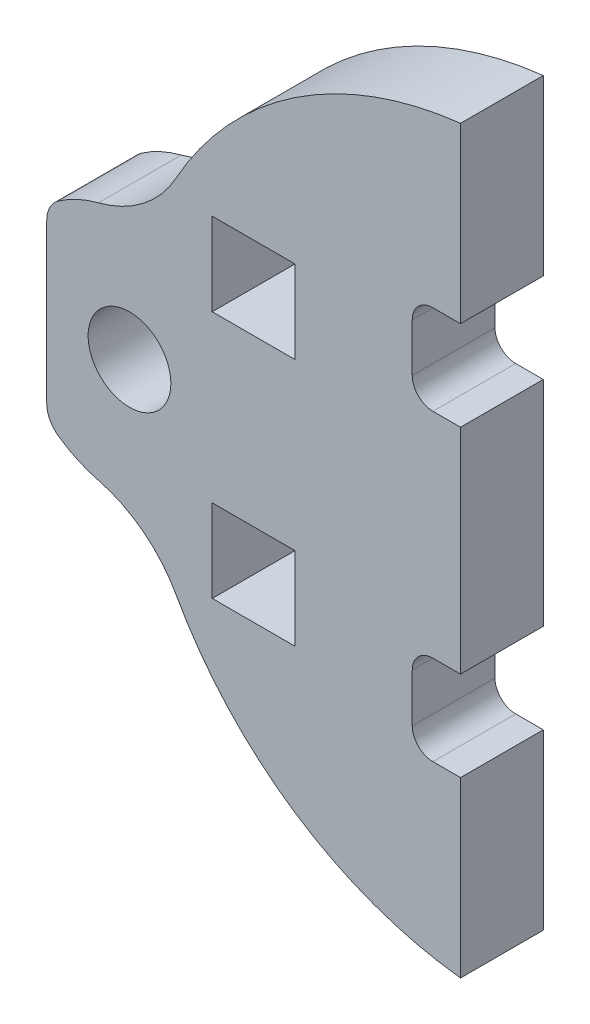
from build123d import *

# Parameters (mm, degrees)
MODEL_R                 = 1.5
MODEL_W                 = 3
MODEL_H                 = 3
SALIENTE_EXTRUIR1_DEPTH = 3


with BuildPart() as part:
    # Model → Saliente-Extruir1 (new body)
    with BuildSketch(Plane.XY):
        with BuildLine():
            Line((11.668043303, 286.574114522), (11.668043303, 280.829551876))
            ThreePointArc((11.668043303, 280.829551876), (11.781638042, 280.366641826), (12.096614731, 280.008900069))
            ThreePointArc((12.096614731, 280.008900069), (12.790231402, 279.612356159), (13.543043303, 279.344726935))
            ThreePointArc((13.543043303, 279.344726935), (15.173719263, 278.545183038), (16.355543303, 277.166173803))
            ThreePointArc((16.355543303, 277.166173803), (20.67525751, 272.472044196), (26.668043303, 270.285425334))
            Line((26.668043303, 270.285425334), (26.668043303, 276.576833199))
            Line((26.668043303, 276.576833199), (25.668043303, 276.576833199))
            ThreePointArc((25.668043303, 276.576833199), (25.137713217, 276.796503113), (24.918043303, 277.326833199))
            Line((24.918043303, 277.326833199), (24.918043303, 279.076833199))
            ThreePointArc((24.918043303, 279.076833199), (25.137713217, 279.607163285), (25.668043303, 279.826833199))
            Line((25.668043303, 279.826833199), (26.668043303, 279.826833199))
            Line((26.668043303, 279.826833199), (26.668043303, 287.576833199))
            Line((26.668043303, 287.576833199), (25.668043303, 287.576833199))
            ThreePointArc((25.668043303, 287.576833199), (25.137713217, 287.796503113), (24.918043303, 288.326833199))
            Line((24.918043303, 288.326833199), (24.918043303, 290.076833199))
            ThreePointArc((24.918043303, 290.076833199), (25.137713217, 290.607163285), (25.668043303, 290.826833199))
            Line((25.668043303, 290.826833199), (26.668043303, 290.826833199))
            Line((26.668043303, 290.826833199), (26.668043303, 297.118241064))
            ThreePointArc((26.668043303, 297.118241064), (20.67525751, 294.931622203), (16.355543303, 290.237492596))
            ThreePointArc((16.355543303, 290.237492596), (15.173719263, 288.858483361), (13.543043303, 288.058939464))
            ThreePointArc((13.543043303, 288.058939464), (12.790231402, 287.79131024), (12.096614731, 287.394766329))
            ThreePointArc((12.096614731, 287.394766329), (11.781638042, 287.037024572), (11.668043303, 286.574114522))
        make_face()
        with Locations((14.668043303, 283.701833199)):
            Circle(MODEL_R, mode=Mode.SUBTRACT)
        with Locations((19.168043303, 288.201833199)):
            Rectangle(MODEL_W, MODEL_H, mode=Mode.SUBTRACT)
        with Locations((19.168043303, 279.201833199)):
            Rectangle(MODEL_W, MODEL_H, mode=Mode.SUBTRACT)
    extrude(amount=SALIENTE_EXTRUIR1_DEPTH)


solid = part.part
